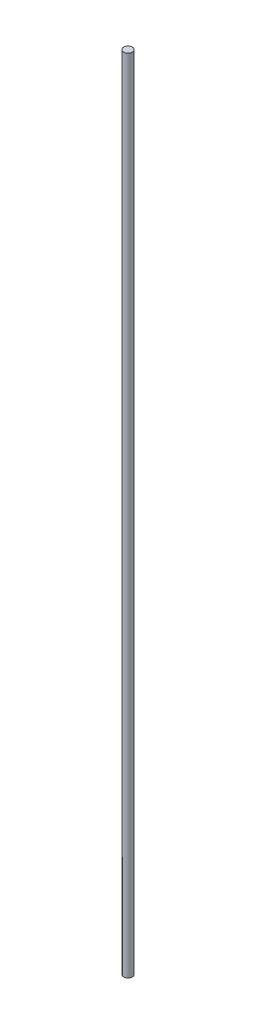
from build123d import *

# Parameters (mm, degrees)
SKETCH1_R           = 3
BOSS_EXTRUDE1_DEPTH = 550


with BuildPart() as part:
    # Sketch1 → Boss-Extrude1 (new body)
    with BuildSketch(Plane(origin=(0, 0, 0), x_dir=(1, 0, 0), z_dir=(0, 1, 0))):
        with Locations(Location((0, 0, 0), (0, 0, 270))):
            Circle(SKETCH1_R)
    extrude(amount=BOSS_EXTRUDE1_DEPTH)


solid = part.part
